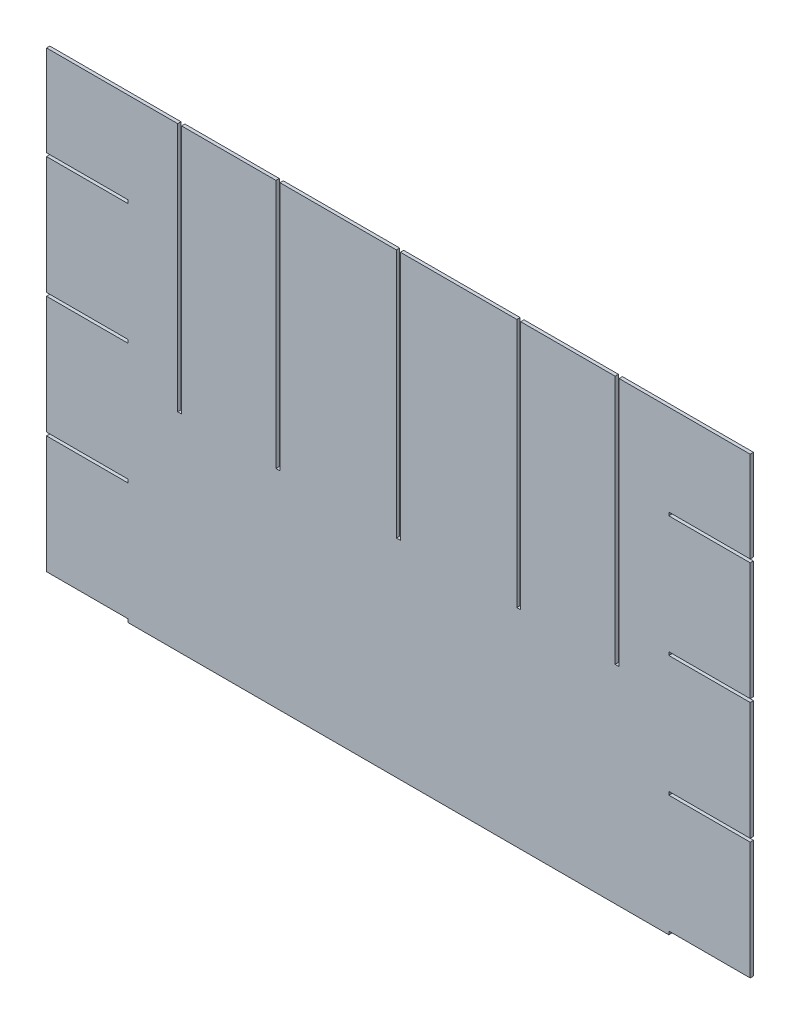
from build123d import *

# Parameters (mm, degrees)
BOSS_EXTRUDE1_DEPTH = 3


with BuildPart() as part:
    # Model → Boss-Extrude1 (new body)
    with BuildSketch(Plane.XY):
        Polygon((-319.984608096, 3), (-245.979700014, 3), (-245.979700014, 0), (245.979700014, 0), (245.979700014, 3), (319.984608096, 3), (319.984608096, 110), (245.979700014, 110), (245.979700014, 113), (319.984608096, 113), (319.984608096, 220), (245.979700014, 220), (245.979700014, 223), (319.984608096, 223), (319.984608096, 330), (245.979700014, 330), (245.979700014, 333), (319.984608096, 333), (319.984608096, 415.56511461), (200.722661621, 415.56511461), (200.722661621, 188.610331254), (197.122661621, 188.610331254), (197.122661621, 415.56511461), (111.3, 415.56511461), (111.3, 188.610331254), (107.7, 188.610331254), (107.7, 415.56511461), (1.8, 415.56511461), (1.8, 188.610331254), (-1.8, 188.610331254), (-1.8, 415.56511461), (-107.7, 415.56511461), (-107.7, 188.610331254), (-111.3, 188.610331254), (-111.3, 415.56511461), (-197.122661621, 415.56511461), (-197.122661621, 188.610331254), (-200.722661621, 188.610331254), (-200.722661621, 415.56511461), (-319.984608096, 415.56511461), (-319.984608096, 333), (-245.979700014, 333), (-245.979700014, 330), (-319.984608096, 330), (-319.984608096, 223), (-245.979700014, 223), (-245.979700014, 220), (-319.984608096, 220), (-319.984608096, 113), (-245.979700014, 113), (-245.979700014, 110), (-319.984608096, 110), align=None)
    extrude(amount=BOSS_EXTRUDE1_DEPTH)


solid = part.part
